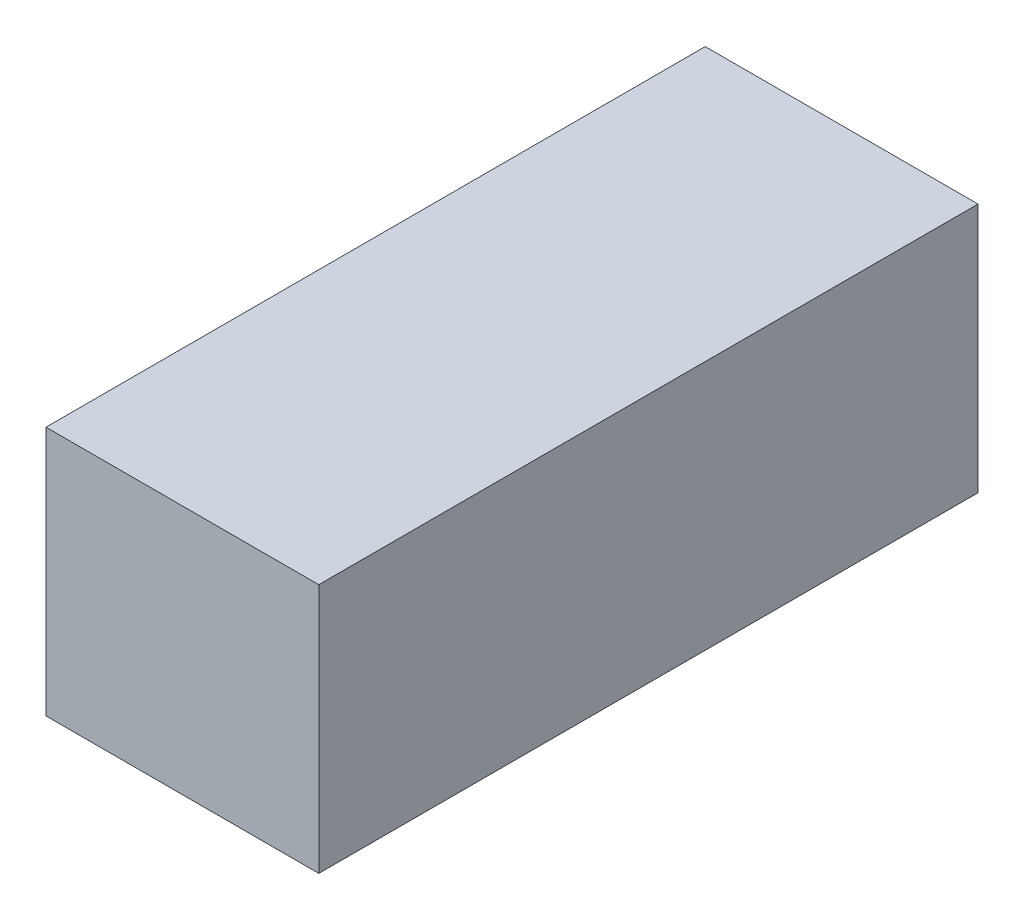
from build123d import *

# Parameters (mm, degrees)
ESQUISSE1_W        = 12
ESQUISSE1_H        = 11
BOSS_EXTRU_1_DEPTH = 29


with BuildPart() as part:
    # Esquisse1 → Boss.-Extru.1 (new body)
    with BuildSketch(Plane.XY):
        Rectangle(ESQUISSE1_W, ESQUISSE1_H)
    extrude(amount=BOSS_EXTRU_1_DEPTH)


solid = part.part
